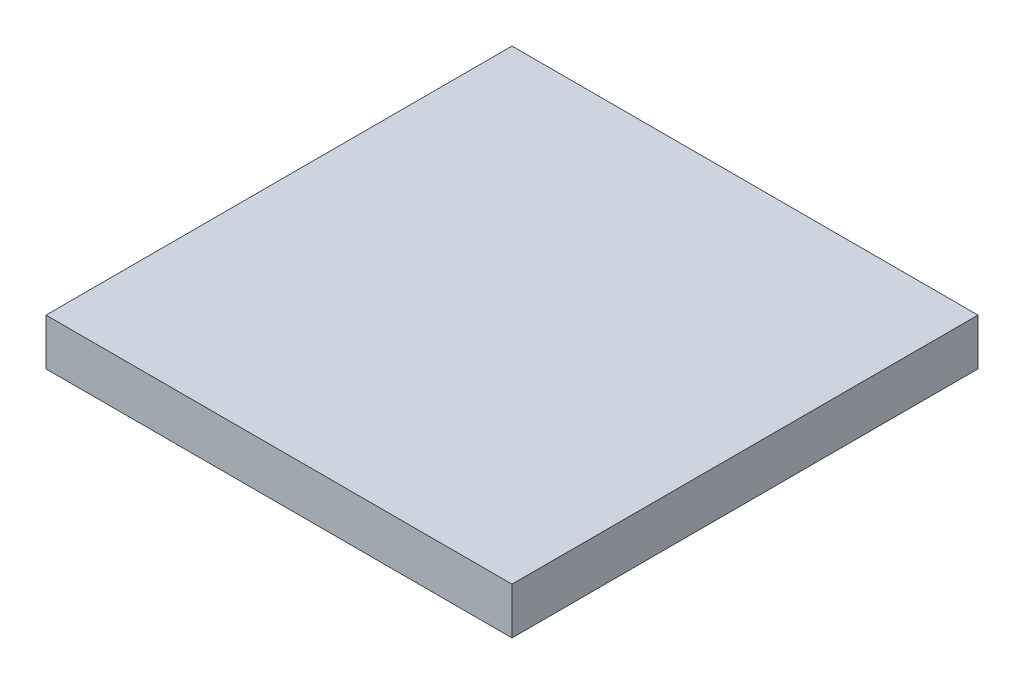
from build123d import *

# Parameters (mm, degrees)
SKETCH_1_W         = 10
SKETCH_1_H         = 1
THIN_2_0_001_DEPTH = 10


with BuildPart() as part:
    # 草图1 → Thin_2_0.001 (new body)
    with BuildSketch(Plane.XY):
        Rectangle(SKETCH_1_W, SKETCH_1_H)
    extrude(amount=THIN_2_0_001_DEPTH)


solid = part.part
